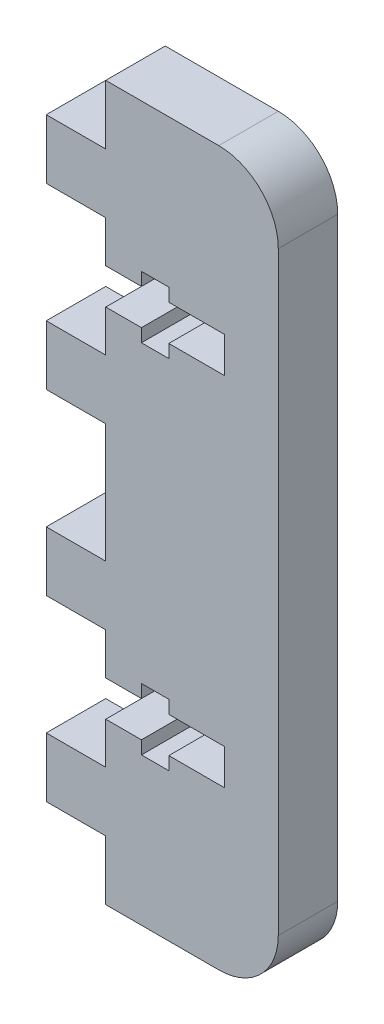
from build123d import *

# Parameters (mm, degrees)
BOSS_EXTRUDE1_DEPTH = 5
FILLET1_R           = 5


with BuildPart() as part:
    # Sketch1 → Boss-Extrude1 (new body)
    with BuildSketch(Plane.XY):
        Polygon((0, 60), (0, 55), (-5, 55), (-5, 50), (0, 50), (0, 46.5), (3, 46.5), (3, 47.6), (5.3, 47.6), (5.3, 46.5), (10, 46.5), (10, 43.5), (5.3, 43.5), (5.3, 42.4), (3, 42.4), (3, 43.5), (0, 43.5), (0, 40), (-5, 40), (-5, 35), (0, 35), (0, 25), (-5, 25), (-5, 20), (0, 20), (0, 16.5), (3, 16.5), (3, 17.6), (5.3, 17.6), (5.3, 16.5), (10, 16.5), (10, 13.5), (5.3, 13.5), (5.3, 12.4), (3, 12.4), (3, 13.5), (0, 13.5), (0, 10), (-5, 10), (-5, 5), (0, 5), (0, 0), (14.5, 0), (14.5, 60), align=None)
    extrude(amount=BOSS_EXTRUDE1_DEPTH)

    # Fillet1
    fillet1_edges = [part.edges().sort_by_distance(p)[0] for p in [
        (14.5, 60, 2.5),
        (14.5, 0, 2.5),
    ]]
    fillet(fillet1_edges, radius=FILLET1_R)


solid = part.part
